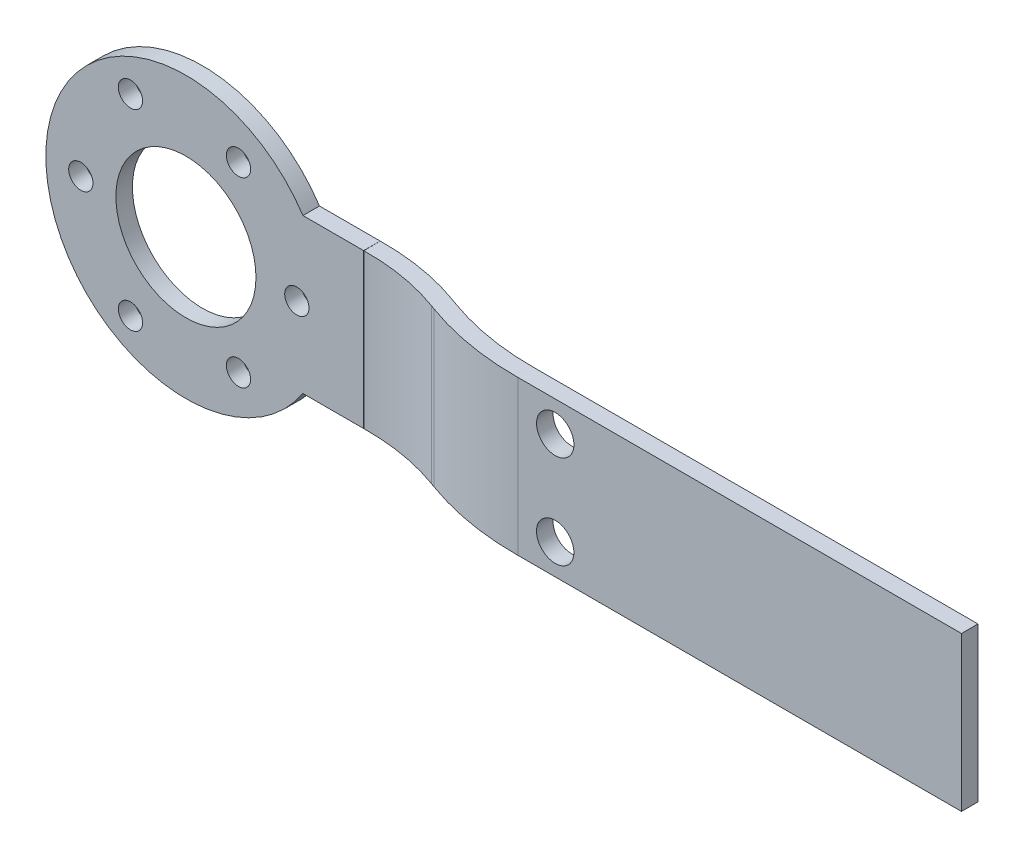
from build123d import *

# Parameters (mm, degrees)
SKETCH1_R           = 30
BOSS_EXTRUDE1_DEPTH = 3.54
BOSS_EXTRUDE4_START = -3.54
BOSS_EXTRUDE4_DEPTH = 3.54
CUT_EXTRUDE1_REACH  = 50.587
SKETCH5_R           = 15
CUT_EXTRUDE2_REACH  = 50.587
SKETCH6_R           = 2.6
BOSS_EXTRUDE5_DEPTH = 33
SKETCH8_R           = 4
CUT_EXTRUDE3_DEPTH  = 10


with BuildPart() as part:
    # Sketch1 → Boss-Extrude1 (new body)
    with BuildSketch(Plane.XY):
        Circle(SKETCH1_R)
    extrude(amount=BOSS_EXTRUDE1_DEPTH)

    # Sketch4 → Boss-Extrude4 (add)
    with BuildSketch(Plane.XY.offset(3.54).offset(BOSS_EXTRUDE4_START)):
        with BuildLine():
            Line((25.054939633, 16.5), (38.054939633, 16.5))
            Line((38.054939633, 16.5), (38.054939633, -16.5))
            Line((38.054939633, -16.5), (25.054939633, -16.5))
            ThreePointArc((25.054939633, -16.5), (30, 0), (25.054939633, 16.5))
        make_face()
    extrude(amount=BOSS_EXTRUDE4_DEPTH)

    # Sketch5 → Cut-Extrude1 (cut, up to next)
    with BuildSketch(Plane.XY.offset(3.54), mode=Mode.PRIVATE) as cut_extrude1_sk1:
        Circle(SKETCH5_R)
    cut_extrude1_tool1 = extrude(cut_extrude1_sk1.sketch, amount=-CUT_EXTRUDE1_REACH, mode=Mode.PRIVATE) & part.part
    add(cut_extrude1_tool1.solids().sort_by_distance((0, 0, 3.54))[0], mode=Mode.SUBTRACT)

    # Sketch6 → Cut-Extrude2 (cut, up to next)
    with BuildSketch(Plane.XY.offset(3.54), mode=Mode.PRIVATE) as cut_extrude2_sk1:
        with Locations((-22.5, 0)):
            Circle(SKETCH6_R)
    cut_extrude2_tool1 = extrude(cut_extrude2_sk1.sketch, amount=-CUT_EXTRUDE2_REACH, mode=Mode.PRIVATE) & part.part
    # Sketch6 → Cut-Extrude2 (cut, up to next)
    with BuildSketch(Plane.XY.offset(3.54), mode=Mode.PRIVATE) as cut_extrude2_sk2:
        with Locations((11.25, 19.485571585)):
            Circle(SKETCH6_R)
    cut_extrude2_tool2 = extrude(cut_extrude2_sk2.sketch, amount=-CUT_EXTRUDE2_REACH, mode=Mode.PRIVATE) & part.part
    # Sketch6 → Cut-Extrude2 (cut, up to next)
    with BuildSketch(Plane.XY.offset(3.54), mode=Mode.PRIVATE) as cut_extrude2_sk3:
        with Locations((11.25, -19.485571585)):
            Circle(SKETCH6_R)
    cut_extrude2_tool3 = extrude(cut_extrude2_sk3.sketch, amount=-CUT_EXTRUDE2_REACH, mode=Mode.PRIVATE) & part.part
    # Sketch6 → Cut-Extrude2 (cut, up to next)
    with BuildSketch(Plane.XY.offset(3.54), mode=Mode.PRIVATE) as cut_extrude2_sk4:
        with Locations((23.75, 0)):
            Circle(SKETCH6_R)
    cut_extrude2_tool4 = extrude(cut_extrude2_sk4.sketch, amount=-CUT_EXTRUDE2_REACH, mode=Mode.PRIVATE) & part.part
    # Sketch6 → Cut-Extrude2 (cut, up to next)
    with BuildSketch(Plane.XY.offset(3.54), mode=Mode.PRIVATE) as cut_extrude2_sk5:
        with Locations((-11.875, -20.56810334)):
            Circle(SKETCH6_R)
    cut_extrude2_tool5 = extrude(cut_extrude2_sk5.sketch, amount=-CUT_EXTRUDE2_REACH, mode=Mode.PRIVATE) & part.part
    # Sketch6 → Cut-Extrude2 (cut, up to next)
    with BuildSketch(Plane.XY.offset(3.54), mode=Mode.PRIVATE) as cut_extrude2_sk6:
        with Locations((-11.875, 20.56810334)):
            Circle(SKETCH6_R)
    cut_extrude2_tool6 = extrude(cut_extrude2_sk6.sketch, amount=-CUT_EXTRUDE2_REACH, mode=Mode.PRIVATE) & part.part
    add(cut_extrude2_tool1.solids().sort_by_distance((-22.5, 0, 3.54))[0], mode=Mode.SUBTRACT)
    add(cut_extrude2_tool2.solids().sort_by_distance((11.25, 19.485572, 3.54))[0], mode=Mode.SUBTRACT)
    add(cut_extrude2_tool3.solids().sort_by_distance((11.25, -19.485572, 3.54))[0], mode=Mode.SUBTRACT)
    add(cut_extrude2_tool4.solids().sort_by_distance((23.75, 0, 3.54))[0], mode=Mode.SUBTRACT)
    add(cut_extrude2_tool5.solids().sort_by_distance((-11.875, -20.568103, 3.54))[0], mode=Mode.SUBTRACT)
    add(cut_extrude2_tool6.solids().sort_by_distance((-11.875, 20.568103, 3.54))[0], mode=Mode.SUBTRACT)


with BuildPart() as body_2:
    # Sketch7 → Boss-Extrude5 (new body)
    with BuildSketch(Plane(origin=(0, 16.5, 0), x_dir=(1, 0, 0), z_dir=(0, 1, 0))):
        with BuildLine():
            Line((78.054939633, -7), (173.054939633, -7))
            Line((173.054939633, -7), (173.054939633, -10.54))
            Line((173.054939633, -10.54), (78.070990419, -10.54))
            ThreePointArc((78.070990419, -10.54), (67.072567905, -9.651997942), (56.407983509, -6.819951839))
            Line((56.407983509, -6.819951839), (55.496978315, -6.488373065))
            ThreePointArc((55.496978315, -6.488373065), (46.933290058, -4.224083077), (38.101791219, -3.539689948))
            Line((38.101791219, -3.539689948), (38.054939633, 0))
            ThreePointArc((38.054939633, 0), (47.524920739, -0.733872032), (56.707729622, -3.161861188))
            Line((56.707729622, -3.161861188), (57.618734817, -3.493439962))
            ThreePointArc((57.618734817, -3.493439962), (67.679379066, -6.164384916), (78.054939633, -7))
        make_face()
    extrude(amount=-BOSS_EXTRUDE5_DEPTH)

    # Sketch8 → Cut-Extrude3 (cut)
    with BuildSketch(Plane.XY.offset(10.54)):
        with Locations((86.070990419, 10)):
            Circle(SKETCH8_R)
        with Locations(Location((86.070990419, -10, 0), (0, 0, 180))):
            Circle(SKETCH8_R)
    extrude(amount=-CUT_EXTRUDE3_DEPTH, mode=Mode.SUBTRACT)


solid = Compound([part.part, body_2.part])
